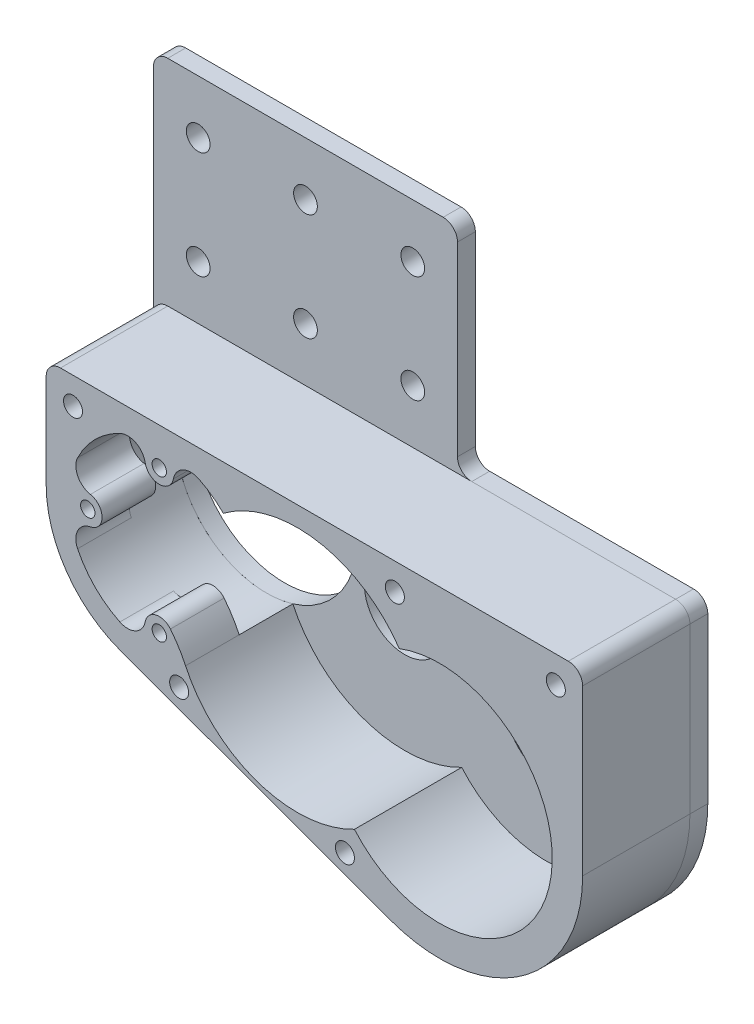
from build123d import *

# Parameters (mm, degrees)
BOSS_EXTRUDE1_DEPTH         = 6.35
SKETCH3_W                   = 107.95
SKETCH3_H                   = 76.2
BOSS_EXTRUDE2_DEPTH         = 6.35
FILLET1_R                   = 5.08
CUT_EXTRUDE1_REACH          = 199.668
SKETCH4_R                   = 14.2875
SKETCH4_R_2                 = 32.2024375
TAP_DRILL_FOR_1_4_20_TAP1_D = 5.1054
F_5_16_CLEARANCE_HOLE1_D    = 8.4328
BOSS_EXTRUDE3_DEPTH         = 38.1
CUT_EXTRUDE3_DEPTH          = 203.504277733
CUT_EXTRUDE3_DEPTH_BACK     = 203.504277733
SKETCH16_R                  = 3.3782
SKETCH17_R                  = 2.5527
BOSS_EXTRUDE4_DEPTH         = 19.05
CUT_EXTRUDE4_DEPTH          = 203.504277733
CUT_EXTRUDE4_DEPTH_BACK     = 203.504277733
SKETCH18_R                  = 3.3782


with BuildPart() as part:
    # Sketch2 → Boss-Extrude1 (new body)
    with BuildSketch(Plane.XY):
        with BuildLine():
            Line((50.8, 63.5), (-139.7, 63.5))
            Line((-139.7, 63.5), (-139.7, 24.9428))
            ThreePointArc((-139.7, 24.9428), (-132.440569937, 1.912367752), (-113.286645893, -12.792302529))
            Line((-113.286645893, -12.792302529), (-17.389986907, -47.730790433))
            ThreePointArc((-17.389986907, -47.730790433), (29.130985781, -41.617612467), (50.8, 0))
            Line((50.8, 0), (50.8, 63.5))
        make_face()
    extrude(amount=-BOSS_EXTRUDE1_DEPTH)

    # Sketch3 → Boss-Extrude2 (add)
    with BuildSketch(Plane.XY):
        with Locations((-85.725, 101.6)):
            Rectangle(SKETCH3_W, SKETCH3_H)
    extrude(amount=-BOSS_EXTRUDE2_DEPTH)

    # Fillet1
    fillet1_edges = [part.edges().sort_by_distance(p)[0] for p in [
        (50.8, 63.5, -3.175),
        (-31.75, 139.7, -3.175),
        (-139.7, 139.7, -3.175),
        (-31.75, 63.5, -3.175),
    ]]
    fillet(fillet1_edges, radius=FILLET1_R)

    # Sketch4 → Cut-Extrude1 (cut, up to next)
    with BuildSketch(Plane.XY, mode=Mode.PRIVATE) as cut_extrude1_sk1:
        Circle(SKETCH4_R)
    cut_extrude1_tool1 = extrude(cut_extrude1_sk1.sketch, amount=-CUT_EXTRUDE1_REACH, mode=Mode.PRIVATE) & part.part
    # Sketch4 → Cut-Extrude1 (cut, up to next)
    with BuildSketch(Plane.XY, mode=Mode.PRIVATE) as cut_extrude1_sk2:
        with Locations((-50.508364656, 12.656618812)):
            Circle(SKETCH4_R)
    cut_extrude1_tool2 = extrude(cut_extrude1_sk2.sketch, amount=-CUT_EXTRUDE1_REACH, mode=Mode.PRIVATE) & part.part
    # Sketch4 → Cut-Extrude1 (cut, up to next)
    with BuildSketch(Plane.XY, mode=Mode.PRIVATE) as cut_extrude1_sk3:
        with Locations((-99.538435713, 24.9428)):
            Circle(SKETCH4_R_2)
    cut_extrude1_tool3 = extrude(cut_extrude1_sk3.sketch, amount=-CUT_EXTRUDE1_REACH, mode=Mode.PRIVATE) & part.part
    add(cut_extrude1_tool1.solids().sort_by_distance((0, 0, 0))[0], mode=Mode.SUBTRACT)
    add(cut_extrude1_tool2.solids().sort_by_distance((-50.508365, 12.656619, 0))[0], mode=Mode.SUBTRACT)
    add(cut_extrude1_tool3.solids().sort_by_distance((-99.538436, 24.9428, 0))[0], mode=Mode.SUBTRACT)

    # Tap Drill for 1/4-20 Tap1 (through all)
    with Locations(Plane.XY):
        with Locations((-33.612632623, -35.061995487), (-92.482563874, -13.613632189), (-130.175, 53.975), (-15.875, 53.975), (41.275, 53.975)):
            Hole(TAP_DRILL_FOR_1_4_20_TAP1_D / 2)

    # 5/16 Clearance Hole1 (through all)
    with Locations(Plane.XY):
        with Locations((-123.825, 120.65), (-85.725, 120.65), (-47.625, 120.65), (-47.625, 82.55), (-85.725, 82.55), (-123.825, 82.55)):
            Hole(F_5_16_CLEARANCE_HOLE1_D / 2)

    # Sketch18 → Cut-Extrude4 (cut, two sides: drawn at the far end of the back side and taken through both)
    with BuildSketch(Plane(origin=(0, 0, -6.35), x_dir=(-1, 0, 0), z_dir=(0, 0, -1)).offset(-CUT_EXTRUDE4_DEPTH_BACK)):
        with Locations(Location((-41.275, 53.975, 0), (0, 0, 180))):
            Circle(SKETCH18_R)
        with Locations(Location((15.875, 53.975, 0), (0, 0, 180))):
            Circle(SKETCH18_R)
        with Locations(Location((33.612632623, -35.061995487, 0), (0, 0, 180))):
            Circle(SKETCH18_R)
        with Locations(Location((92.482563874, -13.613632189, 0), (0, 0, 180))):
            Circle(SKETCH18_R)
        with Locations(Location((130.175, 53.975, 0), (0, 0, 180))):
            Circle(SKETCH18_R)
    extrude(amount=CUT_EXTRUDE4_DEPTH + CUT_EXTRUDE4_DEPTH_BACK, mode=Mode.SUBTRACT)


with BuildPart() as body_2:
    # Sketch15 → Boss-Extrude3 (new body)
    with BuildSketch(Plane.XY):
        with BuildLine():
            Line((-113.286645893, -12.792302529), (-17.389986907, -47.730790433))
            ThreePointArc((-17.389986907, -47.730790433), (29.130985781, -41.617612467), (50.8, 0))
            Line((50.8, 0), (50.8, 58.42))
            ThreePointArc((50.8, 58.42), (49.312102448, 62.012102448), (45.72, 63.5))
            Line((45.72, 63.5), (-134.62, 63.5))
            ThreePointArc((-134.62, 63.5), (-138.212102448, 62.012102448), (-139.7, 58.42))
            Line((-139.7, 58.42), (-139.7, 24.9428))
            ThreePointArc((-139.7, 24.9428), (-132.440569937, 1.912367752), (-113.286645893, -12.792302529))
        make_face()
        with BuildLine():
            ThreePointArc((-76.777799977, 47.723283793), (-130.775087452, 32.770224165), (-90.209656511, -5.878797291))
            ThreePointArc((-90.209656511, -5.878797291), (-64.563565637, -28.842845647), (-30.241161047, -26.189161948))
            ThreePointArc((-30.241161047, -26.189161948), (38.805206992, -9.723987624), (-14.317973269, 37.354995201))
            ThreePointArc((-14.317973269, 37.354995201), (-43.333290134, 55.88013707), (-76.777799977, 47.723283793))
        make_face(mode=Mode.SUBTRACT)
    extrude(amount=BOSS_EXTRUDE3_DEPTH)

    # Sketch16 → Cut-Extrude3 (cut, two sides: drawn at the far end of the back side and taken through both)
    with BuildSketch(Plane.XY.offset(38.1).offset(-CUT_EXTRUDE3_DEPTH_BACK)):
        with Locations((-15.875, 53.975)):
            Circle(SKETCH16_R)
        with Locations((-92.482563874, -13.613632189)):
            Circle(SKETCH16_R)
        with Locations((-33.612632623, -35.061995487)):
            Circle(SKETCH16_R)
        with Locations((41.275, 53.975)):
            Circle(SKETCH16_R)
        with Locations((-130.175, 53.975)):
            Circle(SKETCH16_R)
    extrude(amount=CUT_EXTRUDE3_DEPTH + CUT_EXTRUDE3_DEPTH_BACK, mode=Mode.SUBTRACT)

    # Sketch17 → Boss-Extrude4 (add)
    # profile 1 of 3: a face of its own
    with BuildSketch(Plane.XY.offset(38.1)):
        with BuildLine():
            ThreePointArc((-95.586064862, 2.734220476), (-100.778362851, 4.469155721), (-104.530686061, 0.482925768))
            ThreePointArc((-104.530686061, 0.482925768), (-107.908795404, -4.010275743), (-113.529995198, -4.061221172))
            ThreePointArc((-113.529995198, -4.061221172), (-102.040689842, -7.162272889), (-90.209656511, -5.878797291))
            ThreePointArc((-90.209656511, -5.878797291), (-92.63647604, -1.409127175), (-95.586064862, 2.734220476))
        make_face()
        with Locations((-99.538435713, -0.4572)):
            Circle(SKETCH17_R, mode=Mode.SUBTRACT)
    # profile 2 of 3: a face of its own
    with BuildSketch(Plane.XY.offset(38.1)):
        with BuildLine():
            ThreePointArc((-104.530686061, 49.402674232), (-99.538435713, 45.2628), (-94.546185365, 49.402674232))
            ThreePointArc((-94.546185365, 49.402674232), (-91.168076022, 53.895875743), (-85.546876228, 53.946821172))
            ThreePointArc((-85.546876228, 53.946821172), (-99.538435713, 57.1452375), (-113.529995198, 53.946821172))
            ThreePointArc((-113.529995198, 53.946821172), (-107.908795404, 53.895875743), (-104.530686061, 49.402674232))
        make_face()
        with Locations((-99.538435713, 50.3428)):
            Circle(SKETCH17_R, mode=Mode.SUBTRACT)
    # profile 3 of 3: a face of its own
    with BuildSketch(Plane.XY.offset(38.1)):
        with BuildLine():
            ThreePointArc((-123.998309945, 19.950549652), (-128.491511456, 16.572440309), (-128.542456885, 10.951240515))
            ThreePointArc((-128.542456885, 10.951240515), (-131.740873213, 24.9428), (-128.542456885, 38.934359485))
            ThreePointArc((-128.542456885, 38.934359485), (-128.491511456, 33.313159691), (-123.998309945, 29.935050348))
            ThreePointArc((-123.998309945, 29.935050348), (-119.858435713, 24.9428), (-123.998309945, 19.950549652))
        make_face()
        with Locations((-124.938435713, 24.9428)):
            Circle(SKETCH17_R, mode=Mode.SUBTRACT)
    extrude(amount=-BOSS_EXTRUDE4_DEPTH)


solid = Compound([part.part, body_2.part])
